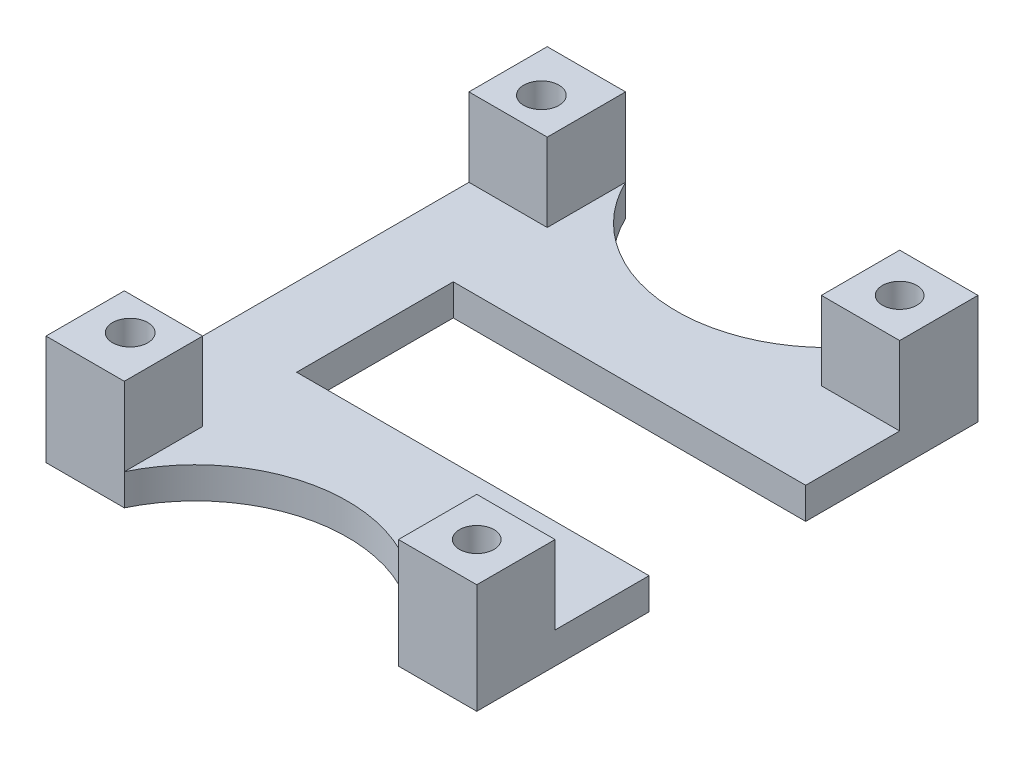
from build123d import *

# Parameters (mm, degrees)
SKETCH1_R                  = 2.2
SKETCH1_R_2                = 2.2479
EXTRUDE_BODY_DEPTH         = 4
SKETCH5_W                  = 10
SKETCH5_H                  = 10
SKETCH5_R                  = 2.2
SKETCH5_R_2                = 2.2479
EXTRUDE_LEGS_DEPTH         = 10
SKETCH6_R                  = 4.215
CUT_BOLT_HEAD_INSETS_DEPTH = 2.5


with BuildPart() as part:
    # Sketch1 → Extrude-Body (new body)
    with BuildSketch(Plane(origin=(0, 0, 0), x_dir=(1, 0, 0), z_dir=(0, 1, 0))):
        with BuildLine():
            Line((10, -10), (10, 10))
            Line((10, 10), (55, 10))
            Line((55, 10), (55, 32))
            Line((55, 32), (45, 32))
            ThreePointArc((45, 32), (27.5, 21), (10, 32))
            Line((10, 32), (0, 32))
            Line((0, 32), (0, -32))
            Line((0, -32), (10, -32))
            ThreePointArc((10, -32), (27.5, -21), (45, -32))
            Line((45, -32), (55, -32))
            Line((55, -32), (55, -10))
            Line((55, -10), (10, -10))
        make_face()
        with Locations(Location((50, 27, 0), (0, 0, 270))):
            Circle(SKETCH1_R, mode=Mode.SUBTRACT)
        with Locations(Location((50, -27, 0), (0, 0, 270))):
            Circle(SKETCH1_R, mode=Mode.SUBTRACT)
        with Locations(Location((5, 26.25, 0), (0, 0, 270))):
            Circle(SKETCH1_R_2, mode=Mode.SUBTRACT)
        with Locations(Location((5, -26.25, 0), (0, 0, 270))):
            Circle(SKETCH1_R_2, mode=Mode.SUBTRACT)
    extrude(amount=EXTRUDE_BODY_DEPTH)

    # Sketch5 → Extrude-Legs (add)
    # profile 1 of 4: a face of its own
    with BuildSketch(Plane(origin=(0, 4, 0), x_dir=(1, 0, 0), z_dir=(0, 1, 0))):
        with Locations((50, -27)):
            Rectangle(SKETCH5_W, SKETCH5_H)
        with Locations(Location((50, -27, 0), (0, 0, 270))):
            Circle(SKETCH5_R, mode=Mode.SUBTRACT)
    # profile 2 of 4: a face of its own
    with BuildSketch(Plane(origin=(0, 4, 0), x_dir=(1, 0, 0), z_dir=(0, 1, 0))):
        with Locations((50, 27)):
            Rectangle(SKETCH5_W, SKETCH5_H)
        with Locations(Location((50, 27, 0), (0, 0, 270))):
            Circle(SKETCH5_R, mode=Mode.SUBTRACT)
    # profile 3 of 4: a face of its own
    with BuildSketch(Plane(origin=(0, 4, 0), x_dir=(1, 0, 0), z_dir=(0, 1, 0))):
        with Locations((5, 27)):
            Rectangle(SKETCH5_W, SKETCH5_H)
        with Locations(Location((5, 26.25, 0), (0, 0, 270))):
            Circle(SKETCH5_R_2, mode=Mode.SUBTRACT)
    # profile 4 of 4: a face of its own
    with BuildSketch(Plane(origin=(0, 4, 0), x_dir=(1, 0, 0), z_dir=(0, 1, 0))):
        with Locations((5, -27)):
            Rectangle(SKETCH5_W, SKETCH5_H)
        with Locations(Location((5, -26.25, 0), (0, 0, 270))):
            Circle(SKETCH5_R_2, mode=Mode.SUBTRACT)
    extrude(amount=EXTRUDE_LEGS_DEPTH)

    # Sketch6 → Cut-Bolt Head Insets (cut)
    with BuildSketch(Plane.XZ):
        with Locations(Location((50, 27, 0), (0, 0, 270))):
            Circle(SKETCH6_R)
        with Locations(Location((50, -27, 0), (0, 0, 270))):
            Circle(SKETCH6_R)
    extrude(amount=-CUT_BOLT_HEAD_INSETS_DEPTH, mode=Mode.SUBTRACT)


solid = part.part
